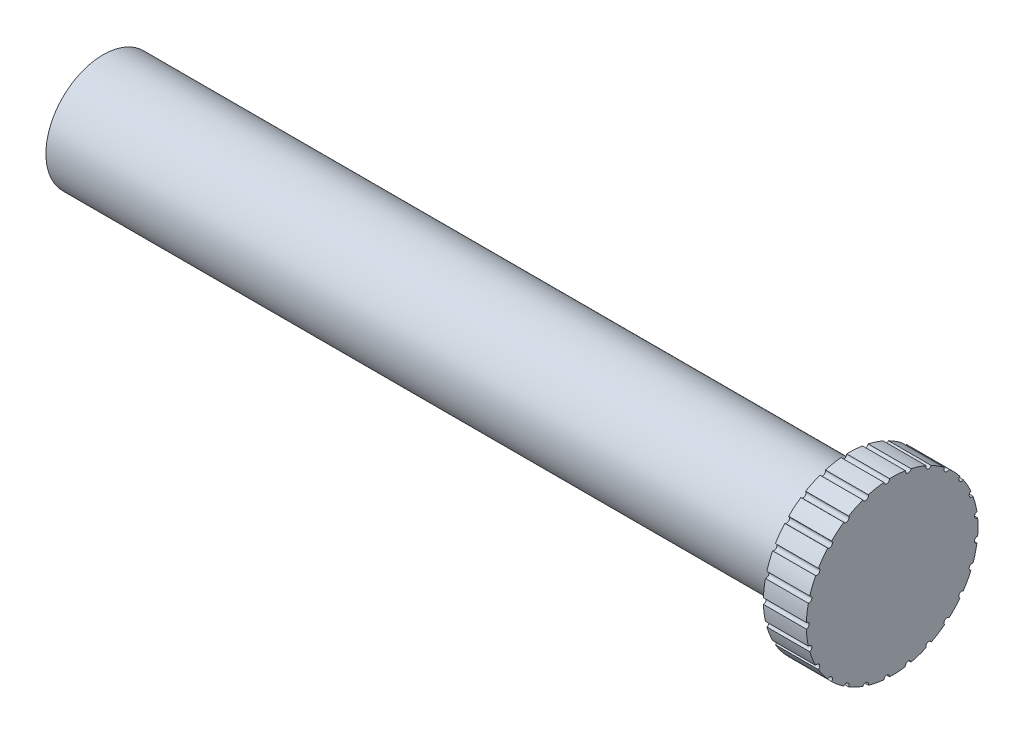
from build123d import *

# Parameters (mm, degrees)
SKETCH1_R           = 4
BOSS_EXTRUDE1_DEPTH = 52.14
SKETCH2_R           = 6
BOSS_EXTRUDE2_DEPTH = 3
CUT_EXTRUDE1_REACH  = 57.789
SKETCH3_R           = 0.2
CIRPATTERN1_COUNT   = 25


with BuildPart() as part:
    # Sketch1 → Boss-Extrude1 (new body)
    with BuildSketch(Plane(origin=(0, 0, 0), x_dir=(0, 0, -1), z_dir=(1, 0, 0))):
        Circle(SKETCH1_R)
    extrude(amount=BOSS_EXTRUDE1_DEPTH)

    # Sketch2 → Boss-Extrude2 (add)
    with BuildSketch(Plane(origin=(52.14, 0, 0), x_dir=(0, 0, -1), z_dir=(1, 0, 0))):
        Circle(SKETCH2_R)
    extrude(amount=BOSS_EXTRUDE2_DEPTH)

    # Sketch3 → Cut-Extrude1 (cut, up to next)
    with BuildSketch(Plane(origin=(55.14, 0, 0), x_dir=(0, 0, -1), z_dir=(1, 0, 0)), mode=Mode.PRIVATE) as cut_extrude1_sk1:
        with Locations((-6, 0)):
            Circle(SKETCH3_R)
    cut_extrude1_tool1 = extrude(cut_extrude1_sk1.sketch, amount=-CUT_EXTRUDE1_REACH, mode=Mode.PRIVATE) & part.part
    cut_extrude1 = cut_extrude1_tool1.solids().sort_by_distance((55.14, 0, 6))[0]
    add(cut_extrude1, mode=Mode.SUBTRACT)

    # CirPattern1: Cut-Extrude1 ×25 about axis
    cirpattern1_axis = Axis((0, 0, 0), (1, 0, 0))
    for i in range(1, CIRPATTERN1_COUNT):
        add(cut_extrude1.rotate(cirpattern1_axis, i * 360 / CIRPATTERN1_COUNT), mode=Mode.SUBTRACT)


solid = part.part
